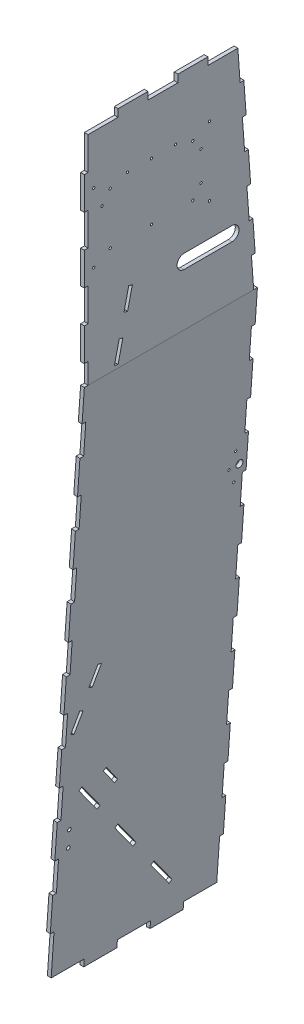
from build123d import *

# Parameters (mm, degrees)
BOSS_EXTRUDE1_DEPTH = 469.9
SKETCH2_W           = 10.16
SKETCH2_H           = 83.651125112
SKETCH2_H_2         = 83.677721465
SKETCH2_H_3         = 83.704317819
SKETCH2_H_4         = 83.730914172
SKETCH2_H_5         = 83.757510526
SKETCH2_H_6         = 83.784106879
SKETCH2_H_7         = 83.810703233
SKETCH2_H_8         = 133.264269193
CUT_EXTRUDE1_DEPTH  = 10.16
SKETCH3_W           = 10.16
SKETCH3_H           = 55.879999965
SKETCH3_H_2         = 88.9
SKETCH3_H_3         = 109.22
CUT_EXTRUDE2_DEPTH  = 12.7
SKETCH4_W           = 81.316938584
SKETCH4_H           = 20.32
SKETCH4_W_2         = 81.316938585
CUT_EXTRUDE3_DEPTH  = 12.7
SKETCH5_W           = 89.916
SKETCH5_H           = 20.32
CUT_EXTRUDE4_DEPTH  = 12.7
CUT_EXTRUDE5_DEPTH  = 137.414
SKETCH8_R           = 9.525
CUT_EXTRUDE7_DEPTH  = 2128.667464702
SKETCH13_R          = 3.175
CUT_EXTRUDE8_DEPTH  = 2128.667464702
CUT_EXTRUDE9_DEPTH  = 2128.667464702
SKETCH20_R          = 4.7625
CUT_EXTRUDE10_DEPTH = 2107.728843747
SKETCH23_R          = 3.175
CUT_EXTRUDE11_DEPTH = 2107.728843747
SKETCH24_R          = 3.243220006
SKETCH24_R_2        = 3
CUT_EXTRUDE12_DEPTH = 63.754


with BuildPart() as part:
    # Sketch1 → Boss-Extrude1 (new body)
    with BuildSketch(Plane.XY):
        Polygon((-215.881789204, 2052.32), (-215.881789204, 1463.040000035), (-316.088635901, 20.32), (-317.499999939, 0), (-307.333509538, 0), (-205.715298803, 1463.040000035), (-205.715298803, 2072.64), (-215.881789204, 2072.64), align=None)
    extrude(amount=-BOSS_EXTRUDE1_DEPTH)

    # Sketch2 → Cut-Extrude1 (cut)
    with BuildSketch(Plane(origin=(-315.975651309, 21.946686571, 0), x_dir=(0, 0, 1), z_dir=(-0.9975965627192115, 0.06928995634877068, 0))):
        with Locations((-464.82, 1313.852971026)):
            Rectangle(SKETCH2_W, SKETCH2_H)
        with Locations((-464.82, 1136.066269203)):
            Rectangle(SKETCH2_W, SKETCH2_H_2)
        with Locations((-464.82, 958.27956738)):
            Rectangle(SKETCH2_W, SKETCH2_H_3)
        with Locations((-464.82, 780.492865556)):
            Rectangle(SKETCH2_W, SKETCH2_H_4)
        with Locations((-464.82, 602.706163733)):
            Rectangle(SKETCH2_W, SKETCH2_H_5)
        with Locations((-464.82, 424.91946191)):
            Rectangle(SKETCH2_W, SKETCH2_H_6)
        with Locations((-464.82, 247.132760087)):
            Rectangle(SKETCH2_W, SKETCH2_H_7)
        with Locations((-464.82, 44.63257346)):
            Rectangle(SKETCH2_W, SKETCH2_H_8)
        with Locations((-5.08, 44.63257346)):
            Rectangle(SKETCH2_W, SKETCH2_H_8)
        with Locations((-5.08, 247.132760087)):
            Rectangle(SKETCH2_W, SKETCH2_H_7)
        with Locations((-5.08, 424.91946191)):
            Rectangle(SKETCH2_W, SKETCH2_H_6)
        with Locations((-5.08, 602.706163733)):
            Rectangle(SKETCH2_W, SKETCH2_H_5)
        with Locations((-5.08, 780.492865556)):
            Rectangle(SKETCH2_W, SKETCH2_H_4)
        with Locations((-5.08, 958.27956738)):
            Rectangle(SKETCH2_W, SKETCH2_H_3)
        with Locations((-5.08, 1136.066269203)):
            Rectangle(SKETCH2_W, SKETCH2_H_2)
        with Locations((-5.08, 1313.852971026)):
            Rectangle(SKETCH2_W, SKETCH2_H)
    extrude(amount=-CUT_EXTRUDE1_DEPTH, mode=Mode.SUBTRACT)

    # Sketch3 → Cut-Extrude2 (cut)
    with BuildSketch(Plane.ZY.offset(215.881789204)):
        with Locations((-5.08, 1490.980000018)):
            Rectangle(SKETCH3_W, SKETCH3_H)
        with Locations((-5.08, 1652.27)):
            Rectangle(SKETCH3_W, SKETCH3_H_2)
        Polygon((-469.9, 1463.040000035), (-459.713026258, 1463.040000035), (-453.620872406, 1546.589538567), (-463.753970086, 1547.328410273), (-457.607940173, 1631.616820512), (-447.474842492, 1630.877948806), (-441.328812579, 1715.166359045), (-451.461910259, 1715.905230751), (-445.315880346, 1800.19364099), (-435.182782665, 1799.454769284), (-429.036752752, 1883.743179522), (-439.169850432, 1884.482051228), (-433.023820518, 1968.770461467), (-422.890722838, 1968.031589761), (-415.263026258, 2072.64), (-469.9, 2072.64), align=None)
        with Locations((-5.08, 1830.07)):
            Rectangle(SKETCH3_W, SKETCH3_H_2)
        with Locations((-5.08, 2018.03)):
            Rectangle(SKETCH3_W, SKETCH3_H_3)
    extrude(amount=-CUT_EXTRUDE2_DEPTH, mode=Mode.SUBTRACT)

    # Sketch4 → Cut-Extrude3 (cut)
    with BuildSketch(Plane.ZY.offset(215.881789204)):
        with Locations((-376.086223632, 2062.48)):
            Rectangle(SKETCH4_W, SKETCH4_H)
        with Locations((-213.452346463, 2062.48)):
            Rectangle(SKETCH4_W_2, SKETCH4_H)
        with Locations((-50.818469292, 2062.48)):
            Rectangle(SKETCH4_W_2, SKETCH4_H)
    extrude(amount=-CUT_EXTRUDE3_DEPTH, mode=Mode.SUBTRACT)

    # Sketch5 → Cut-Extrude4 (cut)
    with BuildSketch(Plane(origin=(-315.975651309, 21.946686571, 0), x_dir=(0, 0, 1), z_dir=(-0.9975965627192115, 0.06928995634877068, 0))):
        with Locations((-414.782, -11.839561137)):
            Rectangle(SKETCH5_W, SKETCH5_H)
        with Locations((-234.95, -11.839561137)):
            Rectangle(SKETCH5_W, SKETCH5_H)
        with Locations((-55.118, -11.839561137)):
            Rectangle(SKETCH5_W, SKETCH5_H)
    extrude(amount=-CUT_EXTRUDE4_DEPTH, mode=Mode.SUBTRACT)

    # Sketch6 → Cut-Extrude5 (cut)
    with BuildSketch(Plane(origin=(-315.975651309, 21.946686571, 0), x_dir=(0, 0, 1), z_dir=(-0.9975965627192115, 0.06928995634877068, 0))):
        Polygon((-225.552848619, 218.022150673), (-217.372552167, 211.996509631), (-163.440168374, 285.214095065), (-171.620464825, 291.239736107), align=None)
        Polygon((-333.417616206, 71.586979805), (-325.230382227, 65.556228551), (-271.297998434, 138.773813985), (-279.485232413, 144.804565239), align=None)
        Polygon((-117.688081031, 364.457321541), (-109.500847052, 358.426570287), (-55.568463259, 431.644155721), (-63.755697238, 437.674906975), align=None)
        Polygon((-22.52887933, 586.435803877), (-44.10850301, 632.676529752), (-53.31924736, 628.378059234), (-31.73962368, 582.137333359), align=None)
        Polygon((-96.478494721, 720.859510985), (-74.89887104, 674.61878511), (-65.68812669, 678.917255627), (-87.26775037, 725.157981502), align=None)
    extrude(amount=-CUT_EXTRUDE5_DEPTH, mode=Mode.SUBTRACT)

    # Sketch8 → Cut-Extrude7 (cut, through all)
    with BuildSketch(Plane.ZY.offset(215.881789204)):
        with Locations((-450.215, 1043.94)):
            Circle(SKETCH8_R)
    extrude(amount=CUT_EXTRUDE7_DEPTH, mode=Mode.SUBTRACT)

    # Sketch13 → Cut-Extrude8 (cut, through all)
    with BuildSketch(Plane.ZY.offset(215.881789204)):
        with BuildLine():
            Line((-400.855976046, 1605.059439633), (-270.871476046, 1605.059439633))
            ThreePointArc((-270.871476046, 1605.059439633), (-251.821476046, 1624.109439633), (-270.871476046, 1643.159439633))
            Line((-270.871476046, 1643.159439633), (-400.855976046, 1643.159439633))
            ThreePointArc((-400.855976046, 1643.159439633), (-419.905976046, 1624.109439633), (-400.855976046, 1605.059439633))
        make_face()
        with Locations((-25.246459893, 1731.87)):
            Circle(SKETCH13_R)
        with Locations((-70.408959893, 1755.42)):
            Circle(SKETCH13_R)
        with Locations((-182.408959893, 1755.42)):
            Circle(SKETCH13_R)
        with Locations((-25.246459893, 1918.97)):
            Circle(SKETCH13_R)
        with Locations((-47.788959893, 1865.42)):
            Circle(SKETCH13_R)
        with Locations((-182.408959893, 1910.42)):
            Circle(SKETCH13_R)
        with Locations((-117.078959893, 1910.42)):
            Circle(SKETCH13_R)
        with Locations((-70.408959893, 1895.42)):
            Circle(SKETCH13_R)
        with Locations((-317.028959893, 1865.42)):
            Circle(SKETCH13_R)
        with Locations((-294.408959893, 1755.42)):
            Circle(SKETCH13_R)
        with Locations((-317.028959893, 1785.42)):
            Circle(SKETCH13_R)
        with Locations((-339.571459893, 1731.87)):
            Circle(SKETCH13_R)
        with Locations((-339.571459893, 1918.97)):
            Circle(SKETCH13_R)
    extrude(amount=-CUT_EXTRUDE8_DEPTH, mode=Mode.SUBTRACT)

    # Sketch17 → Cut-Extrude9 (cut, through all)
    with BuildSketch(Plane.ZY.offset(215.881789204)):
        Polygon((-120.524654614, 1641.945974367), (-130.424254473, 1639.660471655), (-117.483615058, 1583.608404231), (-107.584015199, 1585.893906943), align=None)
        Polygon((-94.643375784, 1529.841839519), (-104.542975642, 1527.556336807), (-91.602336227, 1471.504269383), (-81.702736369, 1473.789772095), align=None)
    extrude(amount=-CUT_EXTRUDE9_DEPTH, mode=Mode.SUBTRACT)

    # Sketch20 → Cut-Extrude10 (cut, through all)
    with BuildSketch(Plane(origin=(-315.975651309, 21.946686571, 0), x_dir=(0, 0, 1), z_dir=(-0.9975965627192116, 0.06928995634876853, 0))):
        Polygon((-128.598334701, 451.361418049), (-162.492565561, 405.347250509), (-154.823537638, 399.698212032), (-120.929306778, 445.712379572), align=None)
        with Locations((-35.56, 347.287639338)):
            Circle(SKETCH20_R)
        with Locations((-35.56, 302.837639338)):
            Circle(SKETCH20_R)
    extrude(amount=-CUT_EXTRUDE10_DEPTH, mode=Mode.SUBTRACT)

    # Sketch23 → Cut-Extrude11 (cut, through all)
    with BuildSketch(Plane(origin=(-315.975651309, 21.946686571, 0), x_dir=(0, 0, 1), z_dir=(-0.9975965627192116, 0.06928995634876853, 0))):
        with Locations((-437.515, 986.355528037)):
            Circle(SKETCH23_R)
        with Locations((-421.64, 1024.455528037)):
            Circle(SKETCH23_R)
        with Locations((-437.515, 1062.555528037)):
            Circle(SKETCH23_R)
    extrude(amount=-CUT_EXTRUDE11_DEPTH, mode=Mode.SUBTRACT)

    # Sketch24 → Cut-Extrude12 (cut)
    with BuildSketch(Plane(origin=(-205.715298803, 0, 0), x_dir=(0, 0, -1), z_dir=(1, 0, 0))):
        with Locations((294.408959893, 1895.42)):
            Circle(SKETCH24_R)
        with Locations((247.738959893, 1910.42)):
            Circle(SKETCH24_R_2)
    extrude(amount=-CUT_EXTRUDE12_DEPTH, mode=Mode.SUBTRACT)


solid = part.part
